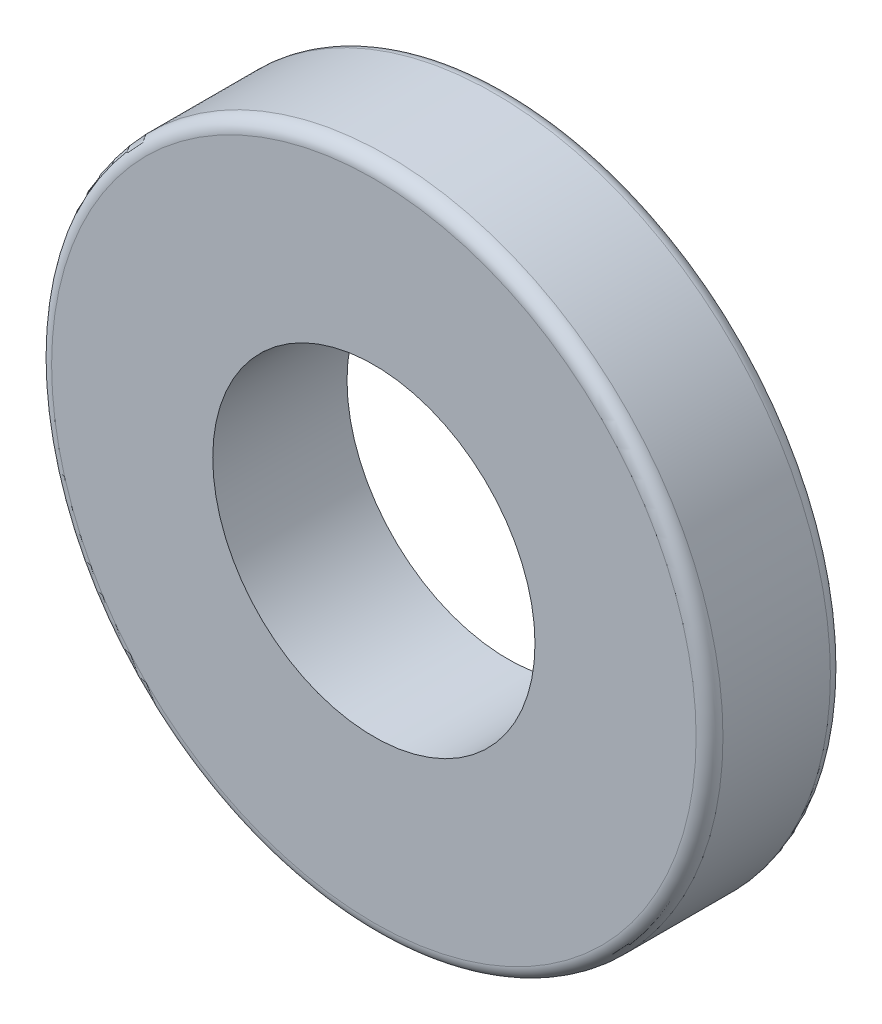
from build123d import *

# Parameters (mm, degrees)
SKETCH1_R           = 6.35
BOSS_EXTRUDE1_DEPTH = 2.54
SKETCH2_R           = 3.048
CUT_EXTRUDE1_DEPTH  = 10.33255592
FILLET1_R           = 0.254


with BuildPart() as part:
    # Sketch1 → Boss-Extrude1 (new body)
    with BuildSketch(Plane.XY):
        Circle(SKETCH1_R)
    extrude(amount=BOSS_EXTRUDE1_DEPTH)

    # Sketch2 → Cut-Extrude1 (cut, through all)
    with BuildSketch(Plane.XY.offset(2.54)):
        Circle(SKETCH2_R)
    extrude(amount=-CUT_EXTRUDE1_DEPTH, mode=Mode.SUBTRACT)

    # Fillet1
    fillet1_edges = [part.edges().sort_by_distance(p)[0] for p in [
        (-6.35, 0, 0),
        (-6.35, 0, 2.54),
    ]]
    fillet(fillet1_edges, radius=FILLET1_R)


solid = part.part
